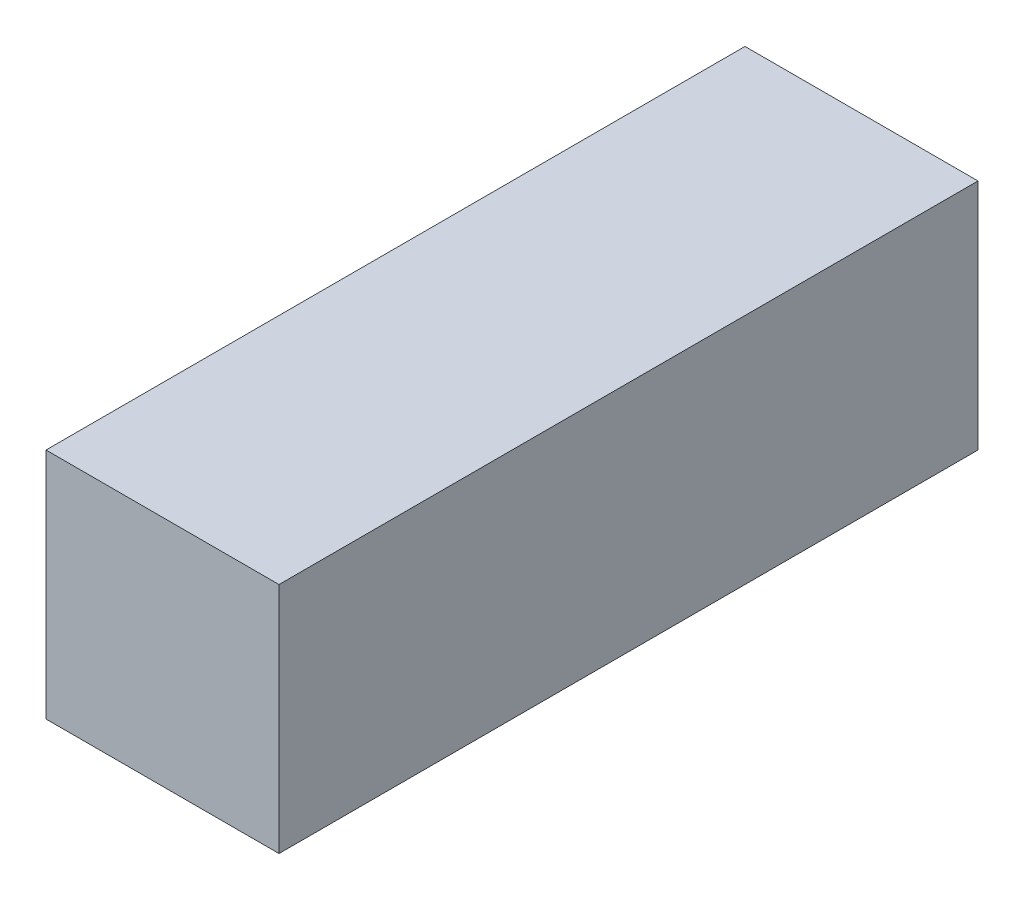
from build123d import *

# Parameters (mm, degrees)
SKETCH1_W           = 50
SKETCH1_H           = 50
BOSS_EXTRUDE1_DEPTH = 150


with BuildPart() as part:
    # Sketch1 → Boss-Extrude1 (new body)
    with BuildSketch(Plane.XY):
        Rectangle(SKETCH1_W, SKETCH1_H)
    extrude(amount=-BOSS_EXTRUDE1_DEPTH)


solid = part.part
